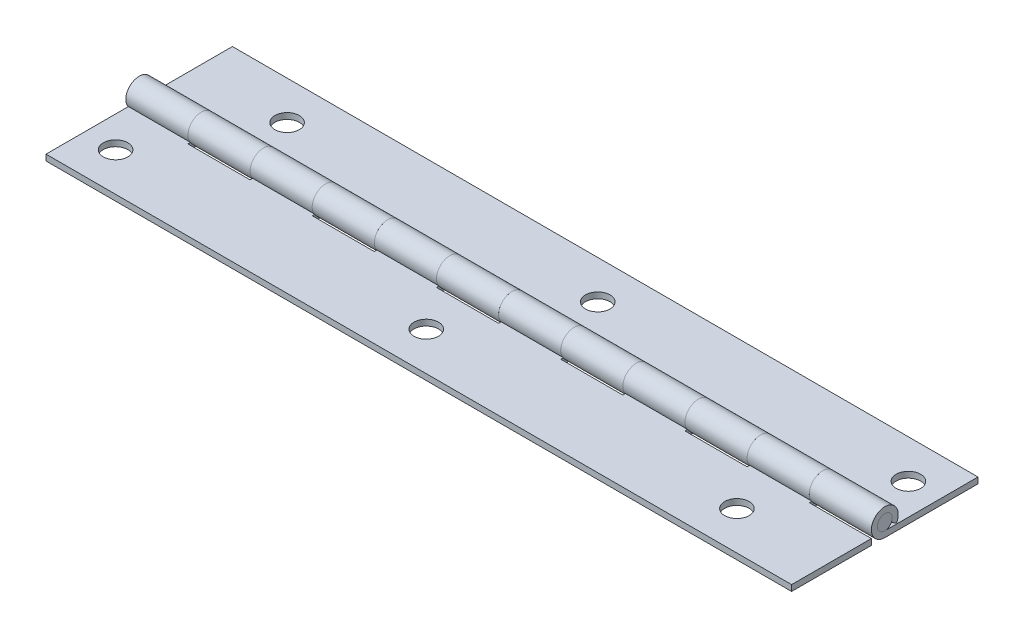
from build123d import *

# Parameters (mm, degrees)
BOSS_EXTRUDE1_DEPTH = 76.2
SKETCH4_W           = 12.7
SKETCH4_H           = 5.4864
CUT_EXTRUDE1_DEPTH  = 79.593050878
LPATTERN1_COUNT     = 6
LPATTERN1_PITCH     = 25.4
SKETCH5_R           = 2.5019
CUT_EXTRUDE2_DEPTH  = 79.660990941
CIRPATTERN1_COUNT   = 2
SKETCH6_R           = 1.524
BOSS_EXTRUDE2_DEPTH = 76.2


with BuildPart() as part:
    # Sketch3 → Boss-Extrude1 (new, symmetric)
    with BuildSketch(Plane(origin=(0, 0, 0), x_dir=(0, 0, -1), z_dir=(1, 0, 0))):
        with BuildLine():
            Line((0, -2.7432), (-19.05, -2.7432))
            Line((-19.05, -2.7432), (-19.05, -1.524))
            Line((-19.05, -1.524), (0, -1.524))
            ThreePointArc((0, -1.524), (0.77286266, 1.313491267), (-1.332215689, -0.740119827))
            Line((-1.332215689, -0.740119827), (-2.39798824, -1.332215689))
            ThreePointArc((-2.39798824, -1.332215689), (1.391152789, 2.36428428), (0, -2.7432))
        make_face()
    extrude(amount=BOSS_EXTRUDE1_DEPTH, both=True)

    # Sketch4 → Cut-Extrude1 (cut, symmetric)
    with BuildSketch(Plane(origin=(0, 0, 0), x_dir=(1, 0, 0), z_dir=(0, 1, 0))):
        with Locations((-57.15, 0)):
            Rectangle(SKETCH4_W, SKETCH4_H)
    cut_extrude1 = extrude(amount=CUT_EXTRUDE1_DEPTH, both=True, mode=Mode.SUBTRACT)

    # LPattern1: Cut-Extrude1 ×6
    with Locations(*[(i * LPATTERN1_PITCH, 0, 0) for i in range(1, LPATTERN1_COUNT)]):
        add(cut_extrude1, mode=Mode.SUBTRACT)

    # Sketch5 → Cut-Extrude2 (cut, through all)
    with BuildSketch(Plane(origin=(0, -1.524, 0), x_dir=(1, 0, 0), z_dir=(0, 1, 0))):
        with Locations(Location((57.15, -11.176, 0), (0, 0, 270))):
            Circle(SKETCH5_R)
        with Locations(Location((-6.35, -11.176, 0), (0, 0, 270))):
            Circle(SKETCH5_R)
        with Locations(Location((-69.85, -11.176, 0), (0, 0, 270))):
            Circle(SKETCH5_R)
    extrude(amount=-CUT_EXTRUDE2_DEPTH, mode=Mode.SUBTRACT)


with BuildPart() as cirpattern1_1:
    # CirPattern1: pattern copy
    add(part.part.rotate(Axis((0, 0, 0), (0, 1, 0)), 1 * 360 / CIRPATTERN1_COUNT))


with BuildPart() as body_3:
    # Sketch6 → Boss-Extrude2 (new, symmetric)
    with BuildSketch(Plane(origin=(0, 0, 0), x_dir=(0, 0, -1), z_dir=(1, 0, 0))):
        with Locations(Location((0, 0, 0), (0, 0, 180))):
            Circle(SKETCH6_R)
    extrude(amount=BOSS_EXTRUDE2_DEPTH, both=True)


solid = Compound([part.part, cirpattern1_1.part, body_3.part])
